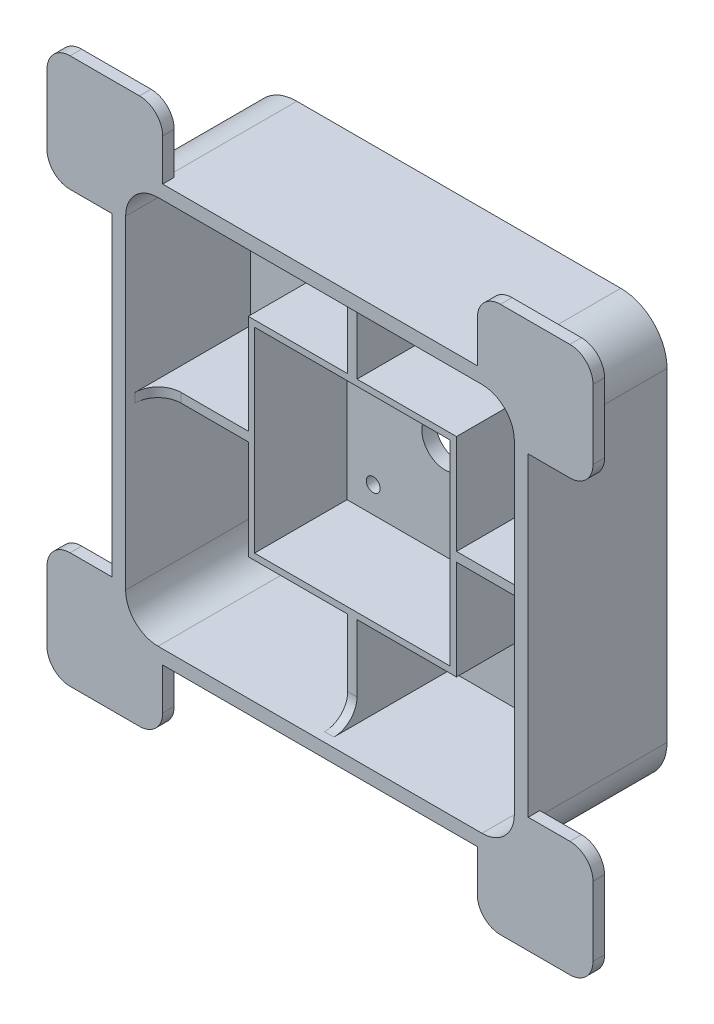
from build123d import *

# Parameters (mm, degrees)
EXTRUDE_1_DEPTH          = 30
SHELL_1_T                = -3
CUT_EXTRUDE_1_REACH      = 72.356
SKETCH_3_R               = 3
SKETCH_4_W               = 45
SKETCH_4_H               = 45
SKETCH_4_W_2             = 42.3
SKETCH_4_H_2             = 42.3
EXTRUDE_3_DEPTH          = 20
SKETCH_11_R              = 1.5
CUT_EXTRUDE_4_DEPTH      = 70.130311731
SKETCH_7_W               = 2
SKETCH_7_H               = 19.5
EXTRUDE_5_DEPTH          = 20
PATTERN_CIRCULAR_1_COUNT = 2
PATTERN_CIRCULAR_1_ANGLE = 90
SKETCH_10_R              = 5
CUT_EXTRUDE_3_DEPTH      = 71.356236397
FILLET_1_R               = 5
EXTRUDE_START            = -2.5
EXTRUDE_6_DEPTH          = 2.5


with BuildPart() as part:
    # 草图1 → 凸台-拉伸1 (new body)
    with BuildSketch(Plane.XY):
        with BuildLine():
            Line((-35, 45), (35, 45))
            ThreePointArc((35, 45), (42.071067812, 42.071067812), (45, 35))
            Line((45, 35), (45, -35))
            ThreePointArc((45, -35), (42.071067812, -42.071067812), (35, -45))
            Line((35, -45), (-35, -45))
            ThreePointArc((-35, -45), (-42.071067812, -42.071067812), (-45, -35))
            Line((-45, -35), (-45, 35))
            ThreePointArc((-45, 35), (-42.071067812, 42.071067812), (-35, 45))
        make_face()
    extrude(amount=EXTRUDE_1_DEPTH)

    # 抽壳1
    shell_1_openings = [part.faces().sort_by_distance(p)[0] for p in [
        (0, 0, 30),
    ]]
    offset(amount=SHELL_1_T, openings=shell_1_openings, kind=Kind.INTERSECTION)

    # 草图3 → 切除-拉伸1 (cut, up to next)
    with BuildSketch(Plane.XY.offset(30), mode=Mode.PRIVATE) as cut_extrude_1_sk1:
        with Locations((-34, 34)):
            Circle(SKETCH_3_R)
    cut_extrude_1_tool1 = extrude(cut_extrude_1_sk1.sketch, amount=-CUT_EXTRUDE_1_REACH, mode=Mode.PRIVATE) & part.part
    # 草图3 → 切除-拉伸1 (cut, up to next)
    with BuildSketch(Plane.XY.offset(30), mode=Mode.PRIVATE) as cut_extrude_1_sk2:
        with Locations((34, 34)):
            Circle(SKETCH_3_R)
    cut_extrude_1_tool2 = extrude(cut_extrude_1_sk2.sketch, amount=-CUT_EXTRUDE_1_REACH, mode=Mode.PRIVATE) & part.part
    # 草图3 → 切除-拉伸1 (cut, up to next)
    with BuildSketch(Plane.XY.offset(30), mode=Mode.PRIVATE) as cut_extrude_1_sk3:
        with Locations((34, -34)):
            Circle(SKETCH_3_R)
    cut_extrude_1_tool3 = extrude(cut_extrude_1_sk3.sketch, amount=-CUT_EXTRUDE_1_REACH, mode=Mode.PRIVATE) & part.part
    # 草图3 → 切除-拉伸1 (cut, up to next)
    with BuildSketch(Plane.XY.offset(30), mode=Mode.PRIVATE) as cut_extrude_1_sk4:
        with Locations((-34, -34)):
            Circle(SKETCH_3_R)
    cut_extrude_1_tool4 = extrude(cut_extrude_1_sk4.sketch, amount=-CUT_EXTRUDE_1_REACH, mode=Mode.PRIVATE) & part.part
    add(cut_extrude_1_tool1.solids().sort_by_distance((-34, 34, 30))[0], mode=Mode.SUBTRACT)
    add(cut_extrude_1_tool2.solids().sort_by_distance((34, 34, 30))[0], mode=Mode.SUBTRACT)
    add(cut_extrude_1_tool3.solids().sort_by_distance((34, -34, 30))[0], mode=Mode.SUBTRACT)
    add(cut_extrude_1_tool4.solids().sort_by_distance((-34, -34, 30))[0], mode=Mode.SUBTRACT)

    # 草图4 → 凸台-拉伸3 (add)
    with BuildSketch(Plane.XY.offset(3)):
        Rectangle(SKETCH_4_W, SKETCH_4_H)
        Rectangle(SKETCH_4_W_2, SKETCH_4_H_2, mode=Mode.SUBTRACT)
    extrude(amount=EXTRUDE_3_DEPTH)

    # 草图11 → 切除-拉伸4 (cut, through all)
    with BuildSketch(Plane.XY.offset(3)):
        with Locations((-15.5, -15.5)):
            Circle(SKETCH_11_R)
        with Locations((15.5, -15.5)):
            Circle(SKETCH_11_R)
        with Locations((15.5, 15.5)):
            Circle(SKETCH_11_R)
        with Locations((-15.5, 15.5)):
            Circle(SKETCH_11_R)
    extrude(amount=-CUT_EXTRUDE_4_DEPTH, mode=Mode.SUBTRACT)

    # 草图7 → 凸台-拉伸5 (add)
    with BuildSketch(Plane.XY.offset(3)):
        with Locations((0, 32.25)):
            Rectangle(SKETCH_7_W, SKETCH_7_H)
        with Locations((0, -32.25)):
            Rectangle(SKETCH_7_W, SKETCH_7_H)
    extrude_5 = extrude(amount=EXTRUDE_5_DEPTH)

    # 阵列(圆周)1: 凸台-拉伸5 ×2 about axis
    pattern_circular_1_axis = Axis((0, 0, -2), (0, 0, 1))
    for i in range(1, PATTERN_CIRCULAR_1_COUNT):
        add(extrude_5.rotate(pattern_circular_1_axis, i * PATTERN_CIRCULAR_1_ANGLE / (PATTERN_CIRCULAR_1_COUNT - 1)))

    # 草图10 → 切除-拉伸3 (cut, through all)
    with BuildSketch(Plane(origin=(0, 0, 0), x_dir=(-1, 0, 0), z_dir=(0, 0, -1))):
        Circle(SKETCH_10_R)
    extrude(amount=-CUT_EXTRUDE_3_DEPTH, mode=Mode.SUBTRACT)

    # 圆角1
    fillet_1_edges = [part.edges().sort_by_distance(p)[0] for p in [
        (0, 42, 23),
        (0, -42, 23),
        (-42, 0, 23),
        (42, 0, 23),
    ]]
    fillet(fillet_1_edges, radius=FILLET_1_R)

    # 草图12 → 凸台-拉伸6 (add)
    with BuildSketch(Plane.XY.offset(30).offset(EXTRUDE_START)):
        with BuildLine():
            Line((34, 42), (35, 42))
            ThreePointArc((35, 42), (39.949747468, 39.949747468), (42, 35))
            Line((42, 35), (42, 34))
            Line((42, 34), (54, 34))
            ThreePointArc((54, 34), (57.535533906, 35.464466094), (59, 39))
            Line((59, 39), (59, 54))
            ThreePointArc((59, 54), (57.535533906, 57.535533906), (54, 59))
            Line((54, 59), (39, 59))
            ThreePointArc((39, 59), (35.464466094, 57.535533906), (34, 54))
            Line((34, 54), (34, 42))
        make_face()
        with BuildLine():
            Line((42, -34), (54, -34))
            ThreePointArc((54, -34), (57.535533906, -35.464466094), (59, -39))
            Line((59, -39), (59, -54))
            ThreePointArc((59, -54), (57.535533906, -57.535533906), (54, -59))
            Line((54, -59), (39, -59))
            ThreePointArc((39, -59), (35.464466094, -57.535533906), (34, -54))
            Line((34, -54), (34, -42))
            Line((34, -42), (35, -42))
            ThreePointArc((35, -42), (39.949747468, -39.949747468), (42, -35))
            Line((42, -35), (42, -34))
        make_face()
        with BuildLine():
            Line((-42, -35), (-42, -34))
            Line((-42, -34), (-54, -34))
            ThreePointArc((-54, -34), (-57.535533906, -35.464466094), (-59, -39))
            Line((-59, -39), (-59, -54))
            ThreePointArc((-59, -54), (-57.535533906, -57.535533906), (-54, -59))
            Line((-54, -59), (-39, -59))
            ThreePointArc((-39, -59), (-35.464466094, -57.535533906), (-34, -54))
            Line((-34, -54), (-34, -42))
            Line((-34, -42), (-35, -42))
            ThreePointArc((-35, -42), (-39.949747468, -39.949747468), (-42, -35))
        make_face()
        with BuildLine():
            Line((-42, 35), (-42, 34))
            Line((-42, 34), (-54, 34))
            ThreePointArc((-54, 34), (-57.535533906, 35.464466094), (-59, 39))
            Line((-59, 39), (-59, 54))
            ThreePointArc((-59, 54), (-57.535533906, 57.535533906), (-54, 59))
            Line((-54, 59), (-39, 59))
            ThreePointArc((-39, 59), (-35.464466094, 57.535533906), (-34, 54))
            Line((-34, 54), (-34, 42))
            Line((-34, 42), (-35, 42))
            ThreePointArc((-35, 42), (-39.949747468, 39.949747468), (-42, 35))
        make_face()
    extrude(amount=EXTRUDE_6_DEPTH)


solid = part.part
